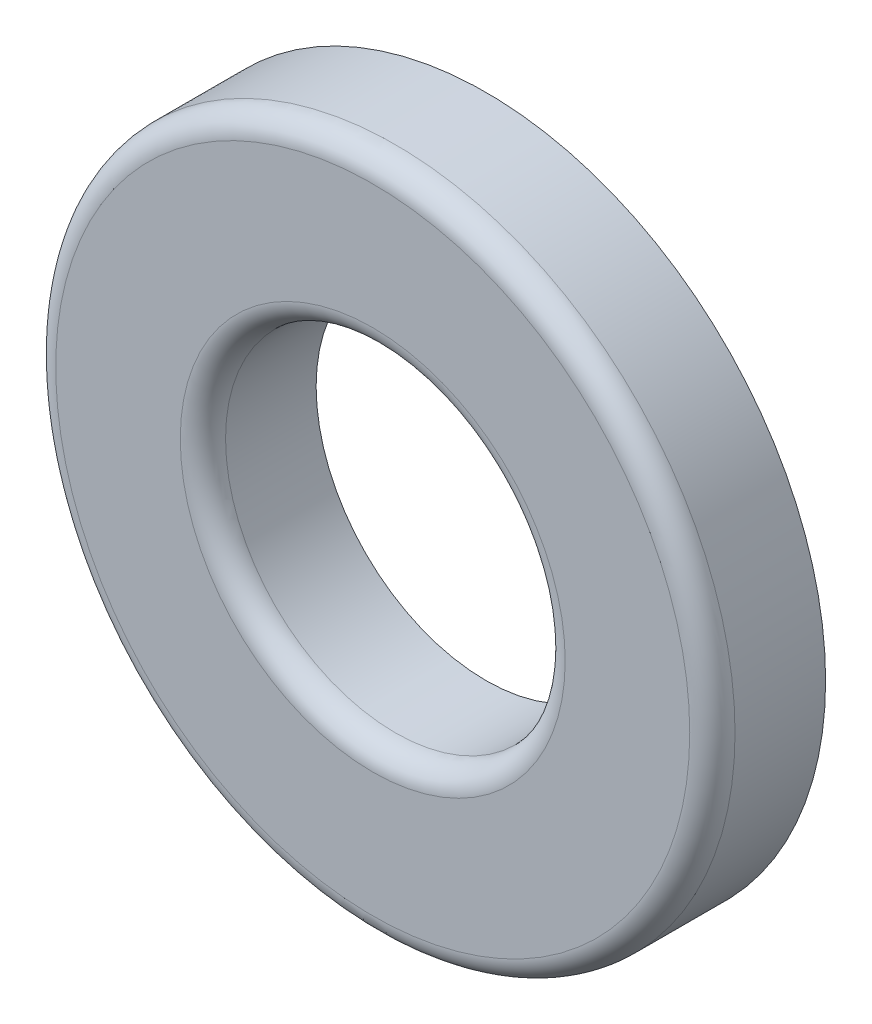
from build123d import *

# Parameters (mm, degrees)
SKETCH1_R           = 30
SKETCH1_R_2         = 15
BOSS_EXTRUDE1_DEPTH = 10
FILLET1_R           = 2


with BuildPart() as part:
    # Sketch1 → Boss-Extrude1 (new body)
    with BuildSketch(Plane.XY):
        Circle(SKETCH1_R)
        Circle(SKETCH1_R_2, mode=Mode.SUBTRACT)
    extrude(amount=BOSS_EXTRUDE1_DEPTH)

    # Fillet1
    fillet1_edges = [part.edges().sort_by_distance(p)[0] for p in [
        (-30, 0, 10),
        (-15, 0, 10),
    ]]
    fillet(fillet1_edges, radius=FILLET1_R)


solid = part.part
